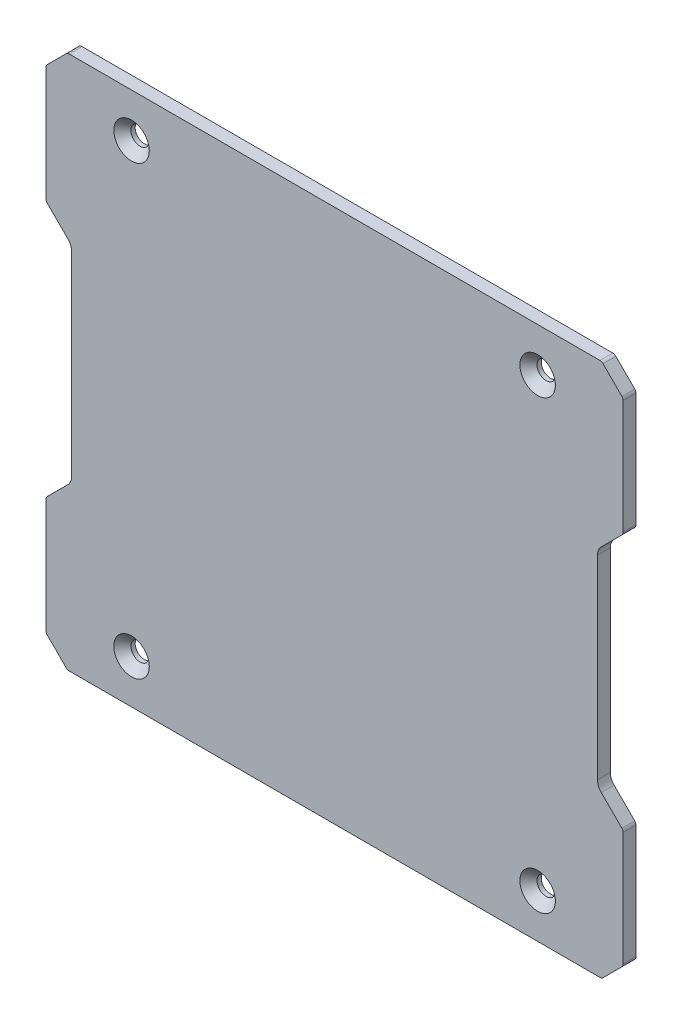
from build123d import *

# Parameters (mm, degrees)
SKETCH_1_R      = 2.15
EXTRUDE_1_DEPTH = 3
CHAMFER_1_SIZE  = 2


with BuildPart() as part:
    # 草图1 → 凸台-拉伸1 (new body)
    with BuildSketch(Plane.XY):
        with BuildLine():
            Line((-61.5, 85.257359313), (-61.5, 39.742640687))
            ThreePointArc((-61.5, 39.742640687), (-61.728361402, 38.59459039), (-62.378679656, 37.621320344))
            Line((-62.378679656, 37.621320344), (-67.207106781, 32.792893219))
            ThreePointArc((-67.207106781, 32.792893219), (-67.423879533, 32.46846987), (-67.5, 32.085786438))
            Line((-67.5, 32.085786438), (-67.5, 5.414213562))
            ThreePointArc((-67.5, 5.414213562), (-67.423879533, 5.03153013), (-67.207106781, 4.707106781))
            Line((-67.207106781, 4.707106781), (-62.792893219, 0.292893219))
            ThreePointArc((-62.792893219, 0.292893219), (-62.46846987, 0.076120467), (-62.085786438, 0))
            Line((-62.085786438, 0), (62.085786438, 0))
            ThreePointArc((62.085786438, 0), (62.46846987, 0.076120467), (62.792893219, 0.292893219))
            Line((62.792893219, 0.292893219), (67.207106781, 4.707106781))
            ThreePointArc((67.207106781, 4.707106781), (67.423879533, 5.03153013), (67.5, 5.414213562))
            Line((67.5, 5.414213562), (67.5, 32.085786438))
            ThreePointArc((67.5, 32.085786438), (67.423879533, 32.46846987), (67.207106781, 32.792893219))
            Line((67.207106781, 32.792893219), (62.378679656, 37.621320344))
            ThreePointArc((62.378679656, 37.621320344), (61.728361402, 38.59459039), (61.5, 39.742640687))
            Line((61.5, 39.742640687), (61.5, 85.257359313))
            ThreePointArc((61.5, 85.257359313), (61.728361402, 86.40540961), (62.378679656, 87.378679656))
            Line((62.378679656, 87.378679656), (67.207106781, 92.207106781))
            ThreePointArc((67.207106781, 92.207106781), (67.423879533, 92.53153013), (67.5, 92.914213562))
            Line((67.5, 92.914213562), (67.5, 119.585786438))
            ThreePointArc((67.5, 119.585786438), (67.423879532, 119.96846987), (67.207106781, 120.292893219))
            Line((67.207106781, 120.292893219), (62.792893219, 124.707106781))
            ThreePointArc((62.792893219, 124.707106781), (62.46846987, 124.923879533), (62.085786438, 125))
            Line((62.085786438, 125), (-62.085786438, 125))
            ThreePointArc((-62.085786438, 125), (-62.46846987, 124.923879533), (-62.792893219, 124.707106781))
            Line((-62.792893219, 124.707106781), (-67.207106781, 120.292893219))
            ThreePointArc((-67.207106781, 120.292893219), (-67.423879533, 119.96846987), (-67.5, 119.585786438))
            Line((-67.5, 119.585786438), (-67.5, 92.914213562))
            ThreePointArc((-67.5, 92.914213562), (-67.423879533, 92.53153013), (-67.207106781, 92.207106781))
            Line((-67.207106781, 92.207106781), (-62.378679656, 87.378679656))
            ThreePointArc((-62.378679656, 87.378679656), (-61.728361402, 86.40540961), (-61.5, 85.257359313))
        make_face()
        with Locations((47.5, 10.25)):
            Circle(SKETCH_1_R, mode=Mode.SUBTRACT)
        with Locations((-47.5, 10.25)):
            Circle(SKETCH_1_R, mode=Mode.SUBTRACT)
        with Locations((-47.5, 114.75)):
            Circle(SKETCH_1_R, mode=Mode.SUBTRACT)
        with Locations((47.5, 114.75)):
            Circle(SKETCH_1_R, mode=Mode.SUBTRACT)
    extrude(amount=EXTRUDE_1_DEPTH)

    # 倒角1
    chamfer_1_edges = [part.edges().sort_by_distance(p)[0] for p in [
        (45.35, 10.25, 3),
        (-49.65, 10.25, 3),
        (-49.65, 114.75, 3),
        (45.35, 114.75, 3),
    ]]
    chamfer(chamfer_1_edges, length=CHAMFER_1_SIZE)


solid = part.part
